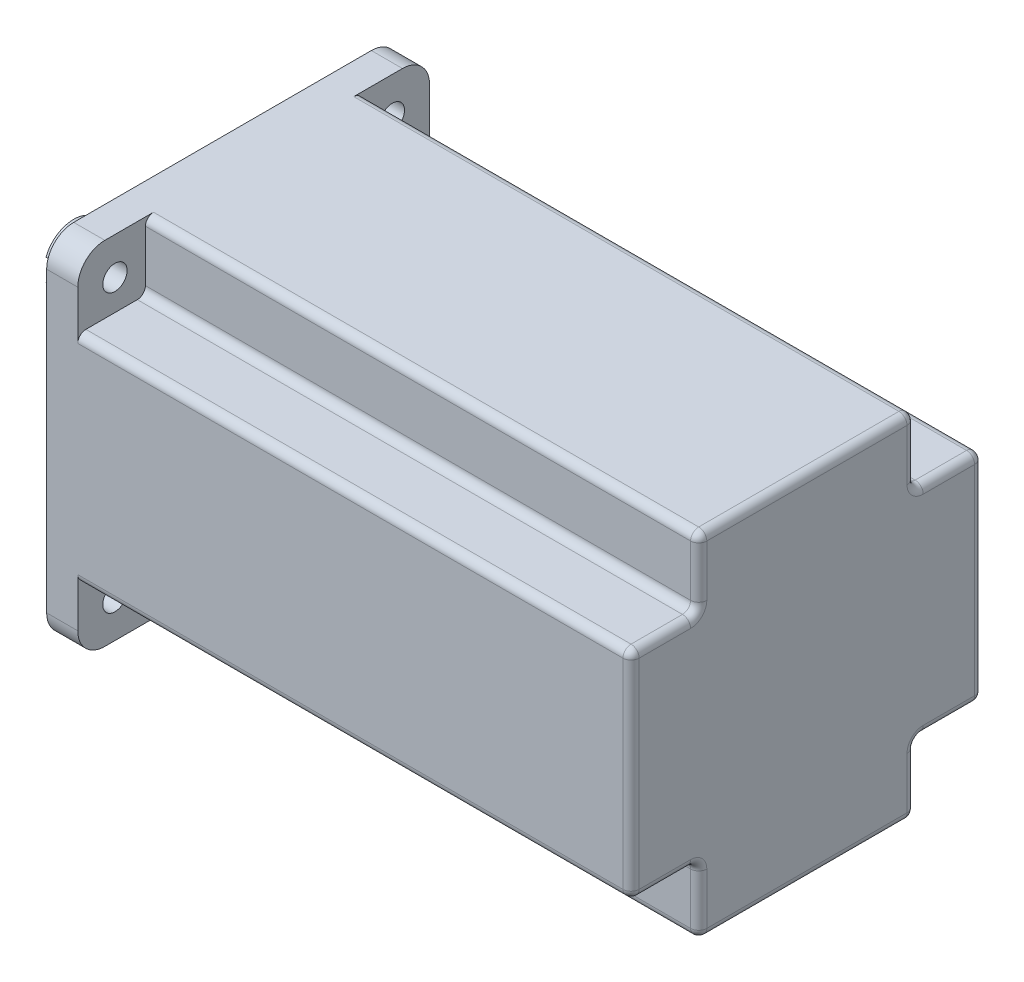
from build123d import *

# Parameters (mm, degrees)
SKETCH1_W                       = 130
SKETCH1_H                       = 130
BOSS_EXTRUDE1_DEPTH             = 11.5
FILLET1_R                       = 10
BOSS_EXTRUDE2_DEPTH             = 204.5
SKETCH3_R                       = 55
BOSS_EXTRUDE3_DEPTH             = 6
SKETCH4_R                       = 11
BOSS_EXTRUDE4_DEPTH             = 55
CUT_EXTRUDE1_START              = 7
CUT_EXTRUDE1_DEPTH              = 113
M6X1_0_TAPPED_HOLE1_D           = 5
M6X1_0_TAPPED_HOLE1_DEPTH       = 20
M6X1_0_TAPPED_HOLE1_CSINK_D     = 6.05
M6X1_0_TAPPED_HOLE1_CSINK_ANGLE = 90
M6X1_0_TAPPED_HOLE1_TIP         = 1.502151548
SKETCH9_R                       = 4.5
CUT_EXTRUDE2_DEPTH              = 20
FILLET2_R                       = 3


with BuildPart() as part:
    # Sketch1 → Boss-Extrude1 (new body)
    with BuildSketch(Plane(origin=(0, 0, 0), x_dir=(0, 0, -1), z_dir=(1, 0, 0))):
        Rectangle(SKETCH1_W, SKETCH1_H)
    extrude(amount=BOSS_EXTRUDE1_DEPTH)

    # Fillet1
    fillet1_edges = [part.edges().sort_by_distance(p)[0] for p in [
        (5.75, -65, -65),
        (5.75, -65, 65),
        (5.75, 65, 65),
        (5.75, 65, -65),
    ]]
    fillet(fillet1_edges, radius=FILLET1_R)

    # Sketch2 → Boss-Extrude2 (add)
    with BuildSketch(Plane(origin=(11.5, 0, 0), x_dir=(0, 0, -1), z_dir=(1, 0, 0))):
        Polygon((-40, 65), (40, 65), (40, 40), (65, 40), (65, -40), (40, -40), (40, -65), (-40, -65), (-40, -40), (-65, -40), (-65, 40), (-40, 40), align=None)
    extrude(amount=BOSS_EXTRUDE2_DEPTH)

    # Sketch3 → Boss-Extrude3 (add)
    with BuildSketch(Plane.ZY):
        Circle(SKETCH3_R)
    extrude(amount=BOSS_EXTRUDE3_DEPTH)

    # Sketch4 → Boss-Extrude4 (add)
    with BuildSketch(Plane.ZY):
        Circle(SKETCH4_R)
    extrude(amount=BOSS_EXTRUDE4_DEPTH)

    # Sketch6 → Cut-Extrude1 (cut)
    with BuildSketch(Plane.XY.offset(CUT_EXTRUDE1_START)):
        with BuildLine():
            Line((-55, 4), (-23, 4))
            ThreePointArc((-23, 4), (-19, 0), (-23, -4))
            Line((-23, -4), (-55, -4))
            ThreePointArc((-55, -4), (-59, 0), (-55, 4))
        make_face()
    extrude(amount=CUT_EXTRUDE1_DEPTH, mode=Mode.SUBTRACT)

    # M6x1.0 Tapped Hole1
    with Locations(Plane.ZY.offset(55)):
        with Locations((0, 0)):
            CounterSinkHole(M6X1_0_TAPPED_HOLE1_D / 2, M6X1_0_TAPPED_HOLE1_CSINK_D / 2, depth=M6X1_0_TAPPED_HOLE1_DEPTH, counter_sink_angle=M6X1_0_TAPPED_HOLE1_CSINK_ANGLE)
            with Locations((0, 0, -(M6X1_0_TAPPED_HOLE1_DEPTH + M6X1_0_TAPPED_HOLE1_TIP / 2))):  # 118° drill point
                Cone(0, M6X1_0_TAPPED_HOLE1_D / 2, M6X1_0_TAPPED_HOLE1_TIP, mode=Mode.SUBTRACT)

    # Sketch9 → Cut-Extrude2 (cut)
    with BuildSketch(Plane.ZY):
        with Locations((51.265241636, 51.265241636)):
            Circle(SKETCH9_R)
        with Locations((51.265241636, -51.265241636)):
            Circle(SKETCH9_R)
        with Locations((-51.265241636, -51.265241636)):
            Circle(SKETCH9_R)
        with Locations((-51.265241636, 51.265241636)):
            Circle(SKETCH9_R)
    extrude(amount=-CUT_EXTRUDE2_DEPTH, mode=Mode.SUBTRACT)

    # Fillet2
    fillet2_edges = [part.edges().sort_by_distance(p)[0] for p in [
        (113.75, 65, 40),
        (113.75, 40, 40),
        (113.75, 40, 65),
        (113.75, -40, 65),
        (113.75, -40, 40),
        (113.75, -65, 40),
        (113.75, -65, -40),
        (113.75, -40, -40),
        (113.75, -40, -65),
        (113.75, 40, -65),
        (113.75, 40, -40),
        (113.75, 65, -40),
        (216, 52.5, 40),
        (216, 40, 52.5),
        (216, 0, 65),
        (216, -40, 52.5),
        (216, -52.5, 40),
        (216, -65, 0),
        (216, -52.5, -40),
        (216, -40, -52.5),
        (216, 0, -65),
        (216, 40, -52.5),
        (216, 52.5, -40),
        (216, 65, 0),
    ]]
    fillet(fillet2_edges, radius=FILLET2_R)


solid = part.part
